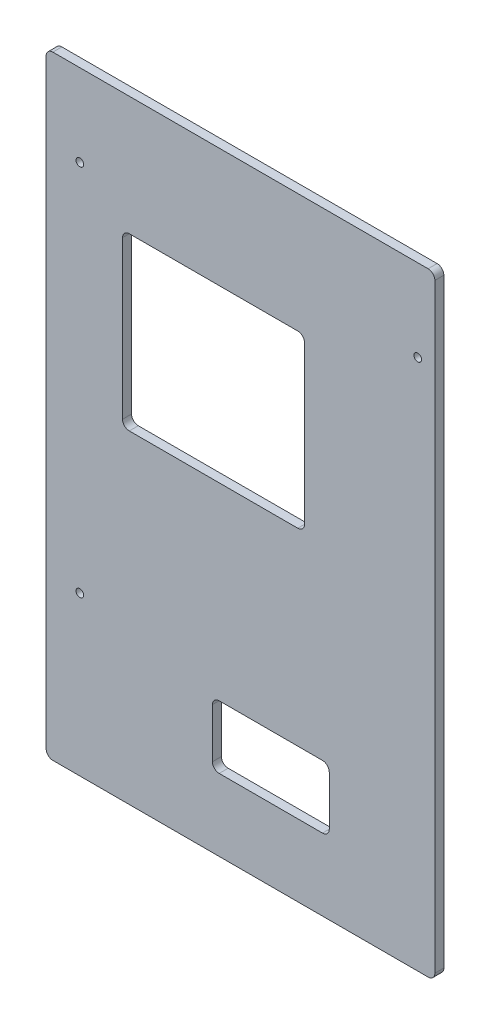
from build123d import *

# Parameters (mm, degrees)
ESQUISSE1_W        = 173
ESQUISSE1_H        = 273
ESQUISSE1_R        = 1.5
ESQUISSE1_W_2      = 52
ESQUISSE1_H_2      = 28
ESQUISSE1_W_3      = 81
ESQUISSE1_H_3      = 76
BOSS_EXTRU_1_DEPTH = 4
D_GAGEMENT_M31_D   = 3.4
CONG_1_R           = 3


with BuildPart() as part:
    # Esquisse1 → Boss.-Extru.1 (new body)
    with BuildSketch(Plane.XY):
        with Locations((86.5, 136.5)):
            Rectangle(ESQUISSE1_W, ESQUISSE1_H)
        with Locations((15, 236.5)):
            Circle(ESQUISSE1_R, mode=Mode.SUBTRACT)
        with Locations((165.38, 236.5)):
            Circle(ESQUISSE1_R, mode=Mode.SUBTRACT)
        with Locations((15, 70.5)):
            Circle(ESQUISSE1_R, mode=Mode.SUBTRACT)
        with Locations((100, 46)):
            Rectangle(ESQUISSE1_W_2, ESQUISSE1_H_2, mode=Mode.SUBTRACT)
        with Locations((74.5, 182)):
            Rectangle(ESQUISSE1_W_3, ESQUISSE1_H_3, mode=Mode.SUBTRACT)
    extrude(amount=BOSS_EXTRU_1_DEPTH)

    # Dégagement M31 (through all)
    with Locations(Plane.XY.offset(4)):
        with Locations((15, 236.5), (15, 70.5), (165.38, 236.5)):
            Hole(D_GAGEMENT_M31_D / 2)

    # Congé1
    cong_1_edges = [part.edges().sort_by_distance(p)[0] for p in [
        (74, 60, 2),
        (74, 32, 2),
        (126, 32, 2),
        (126, 60, 2),
        (34, 220, 2),
        (34, 144, 2),
        (115, 144, 2),
        (115, 220, 2),
        (0, 273, 2),
        (173, 273, 2),
        (173, 0, 2),
        (0, 0, 2),
    ]]
    fillet(cong_1_edges, radius=CONG_1_R)


solid = part.part
